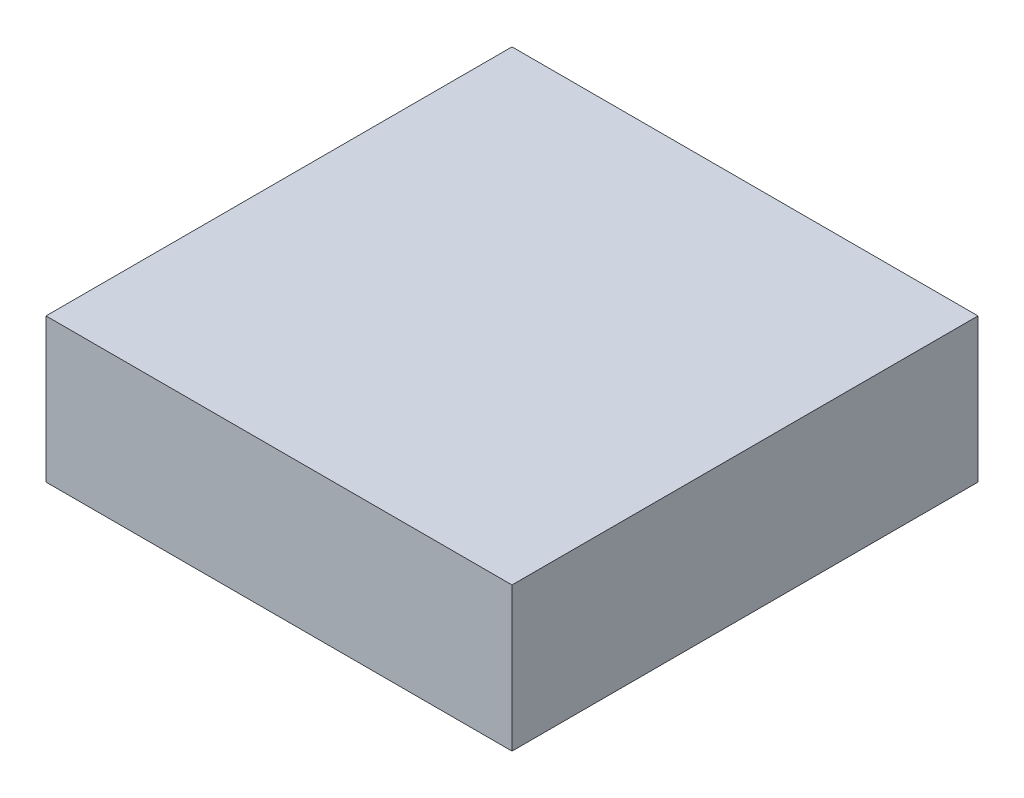
from build123d import *

# Parameters (mm, degrees)
SKETCH1_W      = 11.43
SKETCH1_H      = 11.43
EXTRUDE1_DEPTH = 3.5306


with BuildPart() as part:
    # Sketch1 → Extrude1 (new body)
    with BuildSketch(Plane(origin=(0, 0, 0), x_dir=(1, 0, 0), z_dir=(0, 1, 0))):
        Rectangle(SKETCH1_W, SKETCH1_H)
    extrude(amount=EXTRUDE1_DEPTH)


solid = part.part
